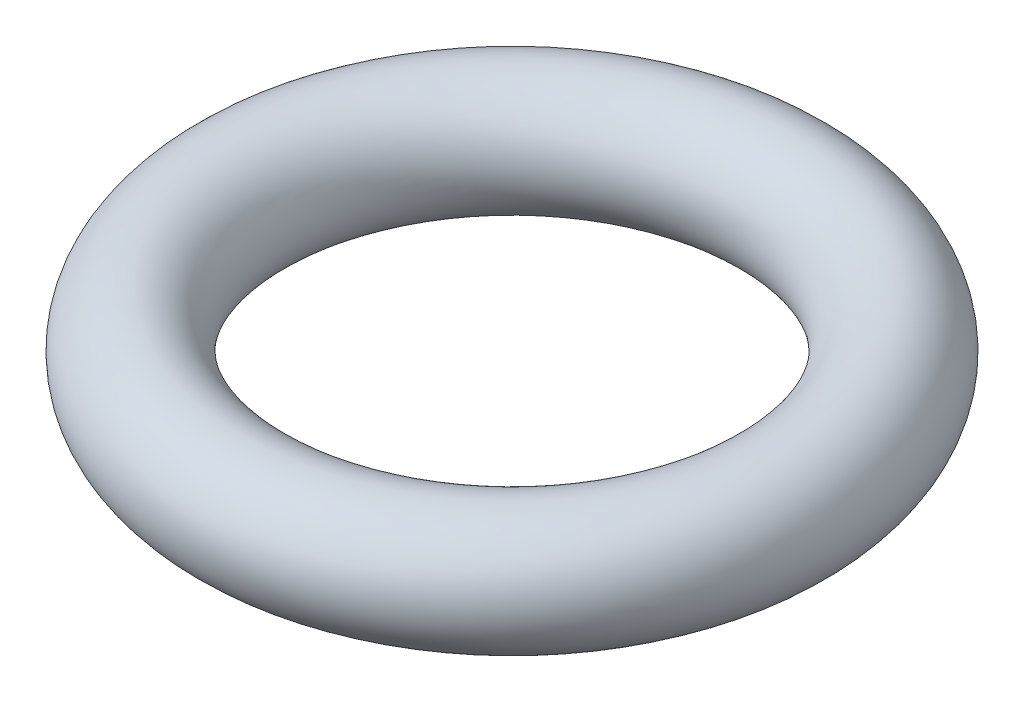
from build123d import *

# Parameters (mm, degrees)
SKETCH2_R = 1.3081


with BuildPart() as part:
    # Sweep1: sweep along a path in Sketch1
    with BuildLine(Plane(origin=(0, 0, 0), x_dir=(1, 0, 0), z_dir=(0, 1, 0))) as sweep1_path:
        CenterArc((0, 0), 4.5974, 0, 360)
    # Sketch2 → Sweep1 (sweep)
    with BuildSketch(Plane.XY):
        with Locations((-5.9055, 0)):
            Circle(SKETCH2_R)
    sweep(path=sweep1_path.line)


solid = part.part
